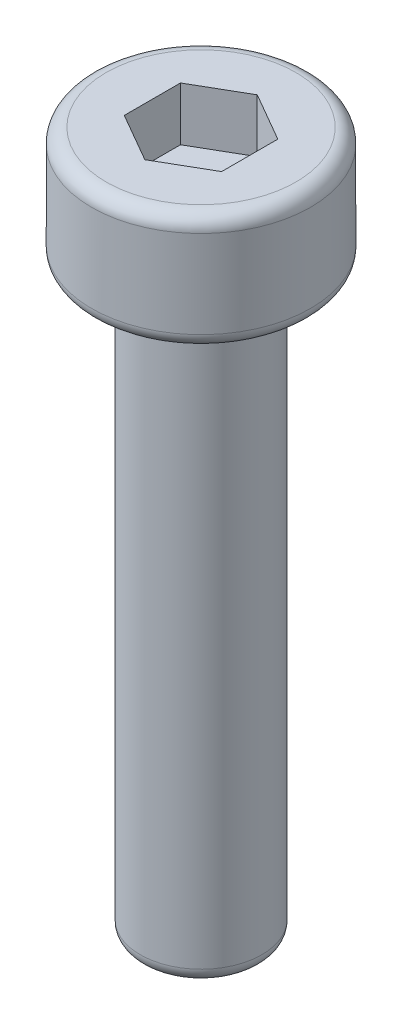
from build123d import *

# Parameters (mm, degrees)
SKETCH_1_W          = 2.25
SKETCH_1_H          = 2.4
SKETCH_2_R          = 1.25
EXTRUDE_1_DEPTH     = 12
CUT_EXTRUDE_1_DEPTH = 1.1
FILLET_1_R          = 0.3


with BuildPart() as part:
    # 草图1 → 旋转1 (revolve)
    with BuildSketch(Plane.XY):
        with Locations((1.125, -1.2)):
            Rectangle(SKETCH_1_W, SKETCH_1_H)
    revolve(axis=Axis((0, 0, 0), (0, -1, 0)))

    # 草图2 → 凸台-拉伸1 (add)
    with BuildSketch(Plane.XZ.offset(2.4)):
        with Locations(Location((0, 0, 0), (0, 0, 270))):
            Circle(SKETCH_2_R)
    extrude(amount=EXTRUDE_1_DEPTH)

    # 草图3 → 切除-拉伸1 (cut)
    with BuildSketch(Plane(origin=(0, 0, 0), x_dir=(-1, 0, 0), z_dir=(0, 1, 0))):
        Polygon((0, -1.154700538), (1, -0.577350269), (1, 0.577350269), (0, 1.154700538), (-1, 0.577350269), (-1, -0.577350269), align=None)
    extrude(amount=-CUT_EXTRUDE_1_DEPTH, mode=Mode.SUBTRACT)

    # 圆角1
    fillet_1_edges = [part.edges().sort_by_distance(p)[0] for p in [
        (0, -14.4, 1.25),
        (-2.25, -2.4, 0),
        (-2.25, 0, 0),
    ]]
    fillet(fillet_1_edges, radius=FILLET_1_R)


solid = part.part
